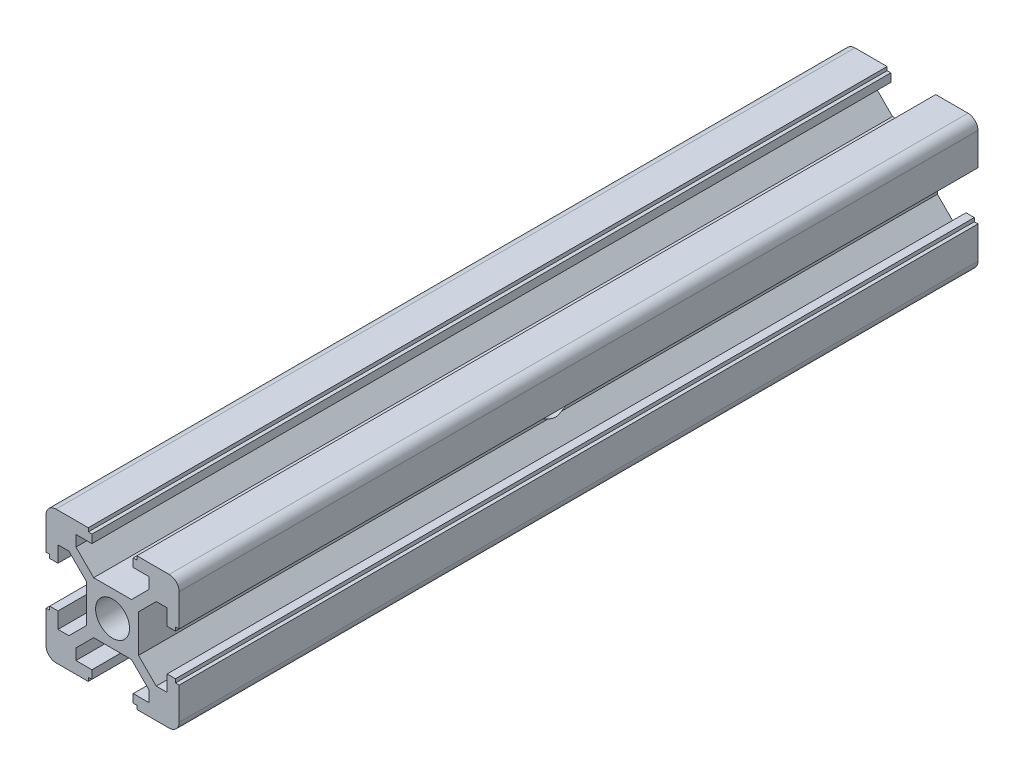
from build123d import *

# Parameters (mm, degrees)
SKETCH_2_R          = 2.55
EXTRUDE_1_DEPTH     = 120
SKETCH_3_R          = 3
CUT_EXTRUDE_1_DEPTH = 123.065556157


with BuildPart() as part:
    # 草图2 → 凸台-拉伸1 (new body)
    with BuildSketch(Plane.XY):
        with BuildLine():
            Line((-3.9, 2.839339828), (-6.560660172, 5.5))
            Line((-6.560660172, 5.5), (-8.2, 5.5))
            Line((-8.2, 5.5), (-8.2, 3.1))
            Line((-8.2, 3.1), (-9.45, 3.1))
            Line((-9.45, 3.1), (-9.45, 3.65))
            Line((-9.45, 3.65), (-10, 3.65))
            Line((-10, 3.65), (-10, 8.5))
            ThreePointArc((-10, 8.5), (-9.560660172, 9.560660172), (-8.5, 10))
            Line((-8.5, 10), (-3.65, 10))
            Line((-3.65, 10), (-3.65, 9.45))
            Line((-3.65, 9.45), (-3.1, 9.45))
            Line((-3.1, 9.45), (-3.1, 8.2))
            Line((-3.1, 8.2), (-5.5, 8.2))
            Line((-5.5, 8.2), (-5.5, 6.560660172))
            Line((-5.5, 6.560660172), (-2.839339828, 3.9))
            Line((-2.839339828, 3.9), (2.839339828, 3.9))
            Line((2.839339828, 3.9), (5.5, 6.560660172))
            Line((5.5, 6.560660172), (5.5, 8.2))
            Line((5.5, 8.2), (3.1, 8.2))
            Line((3.1, 8.2), (3.1, 9.45))
            Line((3.1, 9.45), (3.65, 9.45))
            Line((3.65, 9.45), (3.65, 10))
            Line((3.65, 10), (8.5, 10))
            ThreePointArc((8.5, 10), (9.560660172, 9.560660172), (10, 8.5))
            Line((10, 8.5), (10, 3.65))
            Line((10, 3.65), (9.45, 3.65))
            Line((9.45, 3.65), (9.45, 3.1))
            Line((9.45, 3.1), (8.2, 3.1))
            Line((8.2, 3.1), (8.2, 5.5))
            Line((8.2, 5.5), (6.560660172, 5.5))
            Line((6.560660172, 5.5), (3.9, 2.839339828))
            Line((3.9, 2.839339828), (3.9, -2.839339828))
            Line((3.9, -2.839339828), (6.560660172, -5.5))
            Line((6.560660172, -5.5), (8.2, -5.5))
            Line((8.2, -5.5), (8.2, -3.1))
            Line((8.2, -3.1), (9.45, -3.1))
            Line((9.45, -3.1), (9.45, -3.65))
            Line((9.45, -3.65), (10, -3.65))
            Line((10, -3.65), (10, -8.5))
            ThreePointArc((10, -8.5), (9.560660172, -9.560660172), (8.5, -10))
            Line((8.5, -10), (3.65, -10))
            Line((3.65, -10), (3.65, -9.45))
            Line((3.65, -9.45), (3.1, -9.45))
            Line((3.1, -9.45), (3.1, -8.2))
            Line((3.1, -8.2), (5.5, -8.2))
            Line((5.5, -8.2), (5.5, -6.560660172))
            Line((5.5, -6.560660172), (2.839339828, -3.9))
            Line((2.839339828, -3.9), (-2.839339828, -3.9))
            Line((-2.839339828, -3.9), (-5.5, -6.560660172))
            Line((-5.5, -6.560660172), (-5.5, -8.2))
            Line((-5.5, -8.2), (-3.1, -8.2))
            Line((-3.1, -8.2), (-3.1, -9.45))
            Line((-3.1, -9.45), (-3.65, -9.45))
            Line((-3.65, -9.45), (-3.65, -10))
            Line((-3.65, -10), (-8.5, -10))
            ThreePointArc((-8.5, -10), (-9.560660172, -9.560660172), (-10, -8.5))
            Line((-10, -8.5), (-10, -3.65))
            Line((-10, -3.65), (-9.45, -3.65))
            Line((-9.45, -3.65), (-9.45, -3.1))
            Line((-9.45, -3.1), (-8.2, -3.1))
            Line((-8.2, -3.1), (-8.2, -5.5))
            Line((-8.2, -5.5), (-6.560660172, -5.5))
            Line((-6.560660172, -5.5), (-3.9, -2.839339828))
            Line((-3.9, -2.839339828), (-3.9, 2.839339828))
        make_face()
        Circle(SKETCH_2_R, mode=Mode.SUBTRACT)
    extrude(amount=EXTRUDE_1_DEPTH)

    # 草图3 → 切除-拉伸1 (cut, through all)
    with BuildSketch(Plane(origin=(10, 0, 0), x_dir=(0, 0, -1), z_dir=(1, 0, 0))):
        with Locations(Location((-57.5, 0, 0), (0, 0, 71.16400384))):
            Circle(SKETCH_3_R)
        with Locations((-302.5, 0)):
            Circle(SKETCH_3_R)
    extrude(amount=-CUT_EXTRUDE_1_DEPTH, mode=Mode.SUBTRACT)


solid = part.part
